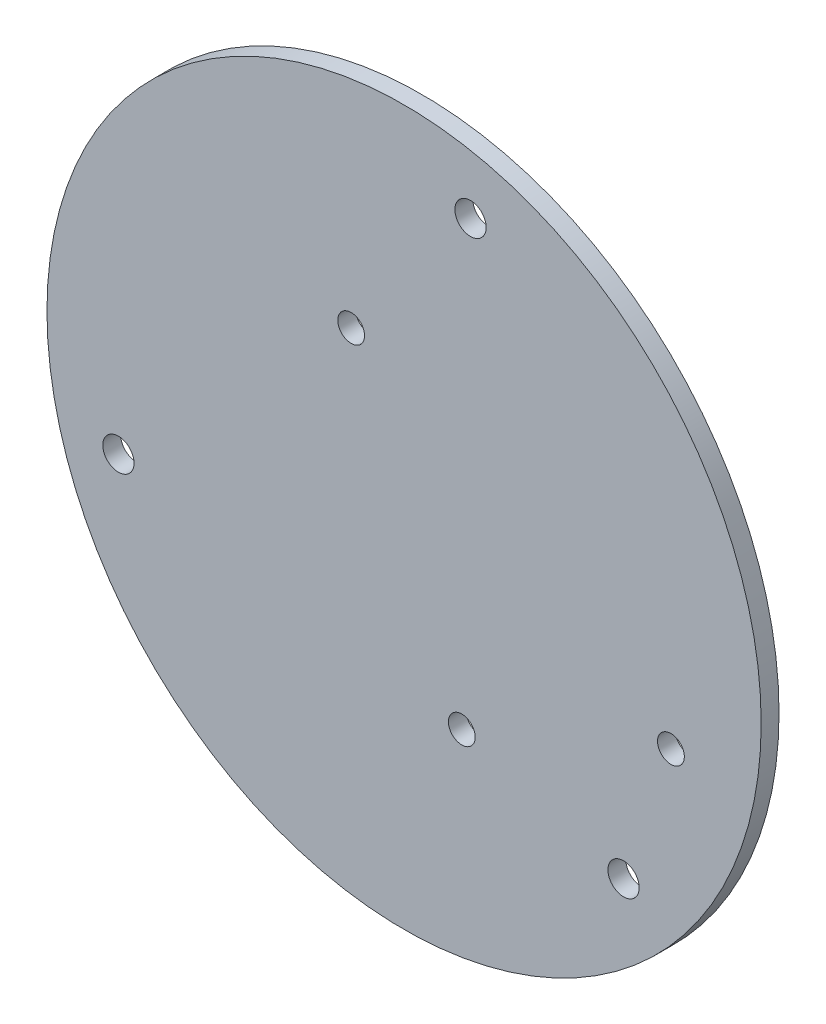
from build123d import *

# Parameters (mm, degrees)
SKETCH1_R           = 40
SKETCH1_R_2         = 1.75
SKETCH1_R_3         = 1.5
BOSS_EXTRUDE1_DEPTH = 2


with BuildPart() as part:
    # Sketch1 → Boss-Extrude1 (new body)
    with BuildSketch(Plane.XY):
        Circle(SKETCH1_R)
        with Locations((-31.995482401, -9.887725266)):
            Circle(SKETCH1_R_2, mode=Mode.SUBTRACT)
        with Locations((24.582160224, -22.784871224)):
            Circle(SKETCH1_R_2, mode=Mode.SUBTRACT)
        with Locations((7.444292234, 32.694804063)):
            Circle(SKETCH1_R_2, mode=Mode.SUBTRACT)
        with Locations((-5.924739338, 15.389926074)):
            Circle(SKETCH1_R_3, mode=Mode.SUBTRACT)
        with Locations((29.890261962, -7.540090975)):
            Circle(SKETCH1_R_3, mode=Mode.SUBTRACT)
        with Locations((6.465875121, -17.361908582)):
            Circle(SKETCH1_R_3, mode=Mode.SUBTRACT)
    extrude(amount=BOSS_EXTRUDE1_DEPTH)


solid = part.part
